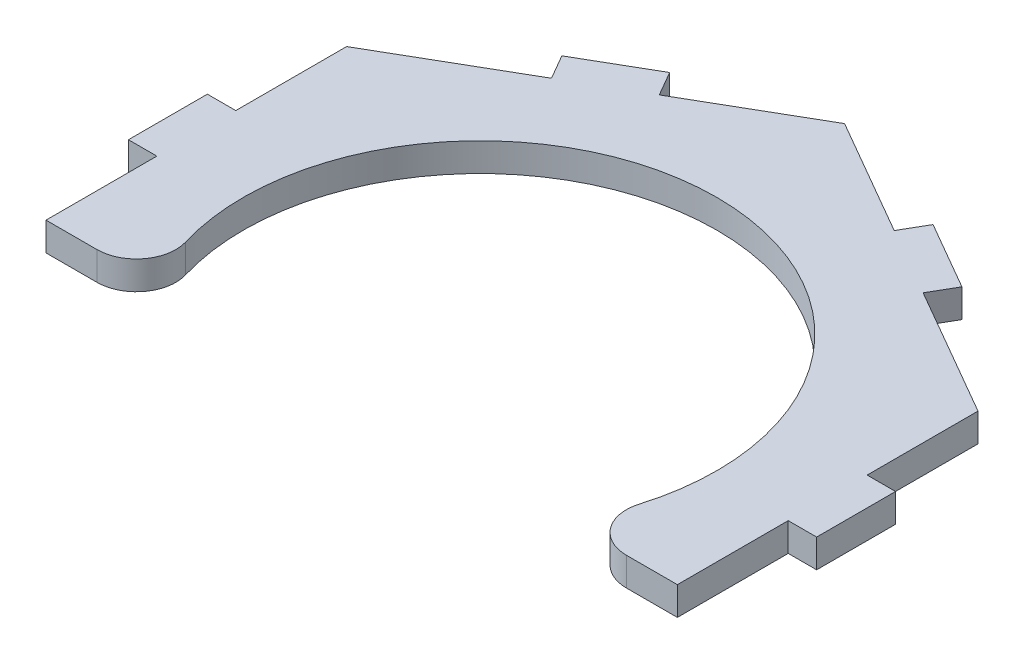
from build123d import *

# Parameters (mm, degrees)
BOSS_EXTRUDE1_DEPTH = 4.572
SKETCH2_W           = 4.572
SKETCH2_H           = 12.7
BOSS_EXTRUDE2_DEPTH = 4.572


with BuildPart() as part:
    # Sketch1 → Boss-Extrude1 (new body)
    with BuildSketch(Plane(origin=(0, 0, 0), x_dir=(1, 0, 0), z_dir=(0, 1, 0))):
        with BuildLine():
            Line((-50.8, -19.05), (-42.597094971, -19.05))
            ThreePointArc((-42.597094971, -19.05), (-37.505768313, -16.494850835), (-36.51179569, -10.885714286))
            ThreePointArc((-36.51179569, -10.885714286), (0, 38.1), (36.51179569, -10.885714286))
            ThreePointArc((36.51179569, -10.885714286), (37.505768313, -16.494850835), (42.597094971, -19.05))
            Line((42.597094971, -19.05), (50.8, -19.05))
            Line((50.8, -19.05), (50.8, 29.329393675))
            Line((50.8, 29.329393675), (0, 58.65878735))
            Line((0, 58.65878735), (-50.8, 29.329393675))
            Line((-50.8, 29.329393675), (-50.8, -19.05))
        make_face()
    extrude(amount=BOSS_EXTRUDE1_DEPTH)

    # Sketch2 → Boss-Extrude2 (add)
    with BuildSketch(Plane(origin=(0, 4.572, 0), x_dir=(1, 0, 0), z_dir=(0, 1, 0))):
        with Locations((-53.086, 5.139696837)):
            Rectangle(SKETCH2_W, SKETCH2_H)
        Polygon((-29.902807007, 41.394393675), (-32.188807007, 45.353861821), (-21.190284379, 51.703861821), (-18.904284379, 47.744393675), align=None)
        Polygon((18.904284379, 47.744393675), (21.190284379, 51.703861821), (32.188807007, 45.353861821), (29.902807007, 41.394393675), align=None)
        with Locations((53.086, 5.139696837)):
            Rectangle(SKETCH2_W, SKETCH2_H)
    extrude(amount=-BOSS_EXTRUDE2_DEPTH)


solid = part.part
